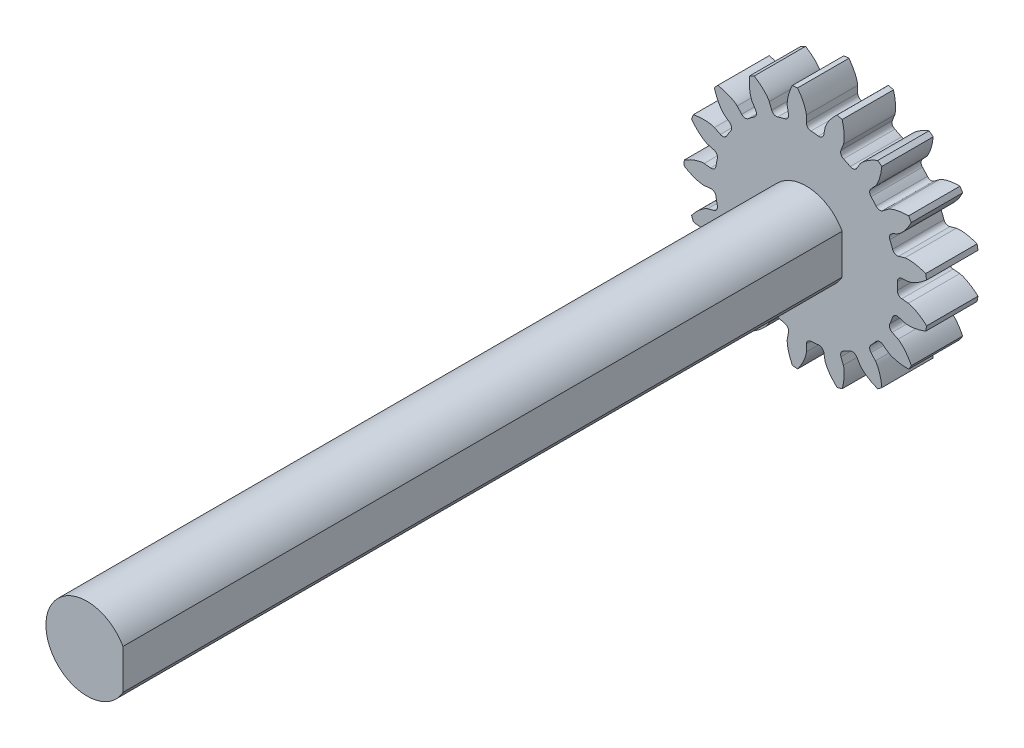
from build123d import *

# Parameters (mm, degrees)
BLANK_SKETCH_R      = 11.875
BLANK_DEPTH         = 5
TOOTH_SPACE_DEPTH   = 18.522307211
TEETH_COUNT         = 17
BORE_DEPTH          = 18.502023289
BORE_DEPTH_BACK     = 18.502023289
BORE_SKETCH_R       = 4
SKETCH1_R           = 4
BOSS_EXTRUDE1_DEPTH = 75
CUT_EXTRUDE1_DEPTH  = 70


with BuildPart() as part:
    # Blank Sketch → Blank (new body)
    with BuildSketch(Plane.XY):
        Circle(BLANK_SKETCH_R)
    extrude(amount=BLANK_DEPTH)

    # Tooth Space Sketch → Tooth Space (cut, symmetric)
    with BuildSketch(Plane.XY):
        with BuildLine():
            Line((9.942364801, 0.91340716), (9.298767719, 0.854279759))
            ThreePointArc((9.298767719, 0.854279759), (8.984863997, 0.694192597), (8.867618155, 0.361902274))
            ThreePointArc((8.867618155, 0.361902274), (8.875, 0), (8.867618155, -0.361902274))
            ThreePointArc((8.867618155, -0.361902274), (8.984863997, -0.694192597), (9.298767719, -0.854279759))
            Line((9.298767719, -0.854279759), (9.942364801, -0.91340716))
            add(Edge.make_bspline(
                [(9.942364801, -0.91340716), (9.947707774, -0.913995463), (9.962658326, -0.915943937), (9.990773403, -0.92080477), (10.03637124, -0.930398576), (10.094010888, -0.945054989), (10.167889919, -0.966771469), (10.254035794, -0.995895766), (10.347670082, -1.031581288), (10.448308522, -1.074335805), (10.547535018, -1.120434221), (10.645345427, -1.169591339), (10.74167088, -1.221399901), (10.856958299, -1.28747082), (10.993207383, -1.371281114), (11.149344102, -1.475798759), (11.322581132, -1.601986981), (11.494732709, -1.73857283), (11.660412139, -1.879471881), (11.823262512, -2.029086969), (11.977584919, -2.17897923), (12.132897457, -2.341825663), (12.273746711, -2.495808162), (12.42574568, -2.675962445), (12.546739308, -2.823606943), (12.666700658, -2.982295404), (12.724336253, -3.060430467), (12.753472124, -3.10073762)],
                knots=[0, 0, 0, 0, 0, 0.005376748, 0.015083688, 0.02853182, 0.046610139, 0.064854849, 0.092110525, 0.119476176, 0.146842495, 0.174208854, 0.201574955, 0.228941013, 0.256307345, 0.307035032, 0.361767351, 0.41649966, 0.471231936, 0.525964282, 0.580696615, 0.635428982, 0.690161387, 0.744893688, 0.799626082, 0.854358408, 0.909090915, 0.909090915, 0.909090915, 0.909090915, 0.909090915], degree=4))
            Line((12.753472124, -3.10073762), (12.753472124, 3.10073762))
            add(Edge.make_bspline(
                [(9.942364801, 0.91340716), (9.947707774, 0.913995463), (9.962658326, 0.915943937), (9.990773403, 0.92080477), (10.03637124, 0.930398576), (10.094010888, 0.945054989), (10.167889919, 0.966771469), (10.254035794, 0.995895766), (10.347670082, 1.031581288), (10.448308522, 1.074335805), (10.547535018, 1.120434221), (10.645345427, 1.169591339), (10.74167088, 1.221399901), (10.856958299, 1.28747082), (10.993207383, 1.371281114), (11.149344102, 1.475798759), (11.322581132, 1.601986981), (11.494732709, 1.73857283), (11.660412139, 1.879471881), (11.823262512, 2.029086969), (11.977584919, 2.17897923), (12.132897457, 2.341825663), (12.273746711, 2.495808162), (12.42574568, 2.675962445), (12.546739308, 2.823606943), (12.666700658, 2.982295404), (12.724336253, 3.060430467), (12.753472124, 3.10073762)],
                knots=[0, 0, 0, 0, 0, 0.005376748, 0.015083688, 0.02853182, 0.046610139, 0.064854849, 0.092110525, 0.119476176, 0.146842495, 0.174208854, 0.201574955, 0.228941013, 0.256307345, 0.307035032, 0.361767351, 0.41649966, 0.471231936, 0.525964282, 0.580696615, 0.635428982, 0.690161387, 0.744893688, 0.799626082, 0.854358408, 0.909090915, 0.909090915, 0.909090915, 0.909090915, 0.909090915], degree=4))
        make_face()
    tooth_space = extrude(amount=TOOTH_SPACE_DEPTH, both=True, mode=Mode.SUBTRACT)

    # Teeth: Tooth Space ×17 about axis
    teeth_axis = Axis((0, 0, -3.75006405), (0, 0, 1))
    for i in range(1, TEETH_COUNT):
        add(tooth_space.rotate(teeth_axis, i * 360 / TEETH_COUNT), mode=Mode.SUBTRACT)

    # Bore Sketch → Bore (cut, two sides: drawn at the far end of the back side and taken through both)
    with BuildSketch(Plane.XY.offset(-BORE_DEPTH_BACK)):
        Circle(BORE_SKETCH_R)
    extrude(amount=BORE_DEPTH + BORE_DEPTH_BACK, mode=Mode.SUBTRACT)

    # Sketch1 → Boss-Extrude1 (add)
    with BuildSketch(Plane(origin=(0, 0, 0), x_dir=(-1, 0, 0), z_dir=(0, 0, -1))):
        Circle(SKETCH1_R)
    extrude(amount=-BOSS_EXTRUDE1_DEPTH)

    # Sketch2 → Cut-Extrude1 (cut)
    with BuildSketch(Plane.XY.offset(5)):
        with BuildLine():
            Line((3.5, 1.936491673), (3.5, -1.936491673))
            ThreePointArc((3.5, -1.936491673), (4, 0), (3.5, 1.936491673))
        make_face()
    extrude(amount=CUT_EXTRUDE1_DEPTH, mode=Mode.SUBTRACT)


solid = part.part
